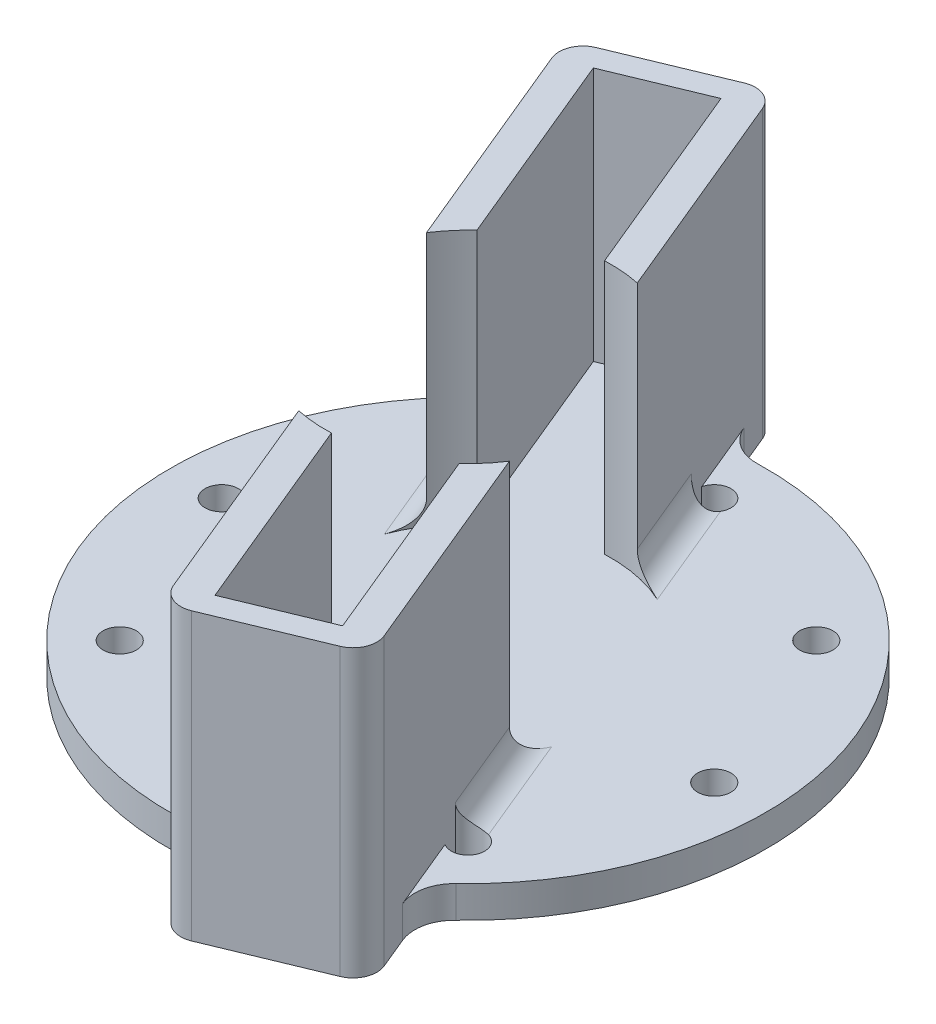
from build123d import *

# Parameters (mm, degrees)
CROQUIS2_R                   = 37.5
SALIENTE_EXTRUIR1_DEPTH      = 4
CROQUIS3_R                   = 2.1
CORTAR_EXTRUIR1_DEPTH        = 4
SALIENTE_EXTRUIR2_DEPTH      = 20
SALIENTE_EXTRUIR2_DEPTH_BACK = 4
SALIENTE_EXTRUIR3_DEPTH      = 20
SALIENTE_EXTRUIR3_DEPTH_BACK = 4
CORTAR_EXTRUIR2_DEPTH        = 20
CROQUIS9_R                   = 18
CORTAR_EXTRUIR3_DEPTH        = 20
REDONDEO1_R                  = 3
REDONDEO2_R                  = 3
REDONDEO3_R                  = 5
CORTAR_EXTRUIR4_DEPTH        = 20
SALIENTE_EXTRUIR4_START      = 12
SALIENTE_EXTRUIR4_DEPTH      = 12


with BuildPart() as part:
    # Croquis2 → Saliente-Extruir1 (new body)
    with BuildSketch(Plane(origin=(0, 0, 0), x_dir=(1, 0, 0), z_dir=(0, 1, 0))):
        with Locations(Location((0, 0, 0), (0, 0, 270))):
            Circle(CROQUIS2_R)
    extrude(amount=SALIENTE_EXTRUIR1_DEPTH)

    # Croquis3 → Cortar-Extruir1 (cut)
    with BuildSketch(Plane(origin=(0, 4, 0), x_dir=(1, 0, 0), z_dir=(0, 1, 0))):
        with Locations(Location((0, 31, 0), (0, 0, 270))):
            Circle(CROQUIS3_R)
        with Locations(Location((21.920310217, 21.920310217, 0), (0, 0, 270))):
            Circle(CROQUIS3_R)
        with Locations(Location((31, 0, 0), (0, 0, 270))):
            Circle(CROQUIS3_R)
        with Locations(Location((21.920310217, -21.920310217, 0), (0, 0, 270))):
            Circle(CROQUIS3_R)
        with Locations(Location((0, -31, 0), (0, 0, 270))):
            Circle(CROQUIS3_R)
        with Locations(Location((-21.920310217, -21.920310217, 0), (0, 0, 270))):
            Circle(CROQUIS3_R)
        with Locations(Location((-31, 0, 0), (0, 0, 270))):
            Circle(CROQUIS3_R)
        with Locations(Location((-21.920310217, 21.920310217, 0), (0, 0, 270))):
            Circle(CROQUIS3_R)
    extrude(amount=-CORTAR_EXTRUIR1_DEPTH, mode=Mode.SUBTRACT)

    # Croquis4 → Saliente-Extruir2 (add, two sides: drawn at the far end of the back side and taken through both)
    with BuildSketch(Plane(origin=(0, 4, 0), x_dir=(1, 0, 0), z_dir=(0, 1, 0)).offset(-SALIENTE_EXTRUIR2_DEPTH_BACK)):
        with BuildLine():
            ThreePointArc((8.474466938, -36.529897483), (11.451375588, -35.708766391), (14.350628714, -34.645482469))
            Line((14.350628714, -34.645482469), (-14.350628714, 34.645482469))
            ThreePointArc((-14.350628714, 34.645482469), (-17.15256553, 33.347256195), (-19.838185188, 31.822891265))
            Line((-19.838185188, 31.822891265), (8.474466938, -36.529897483))
        make_face()
        with BuildLine():
            Line((-14.350628714, 34.645482469), (14.350628714, -34.645482469))
            ThreePointArc((14.350628714, -34.645482469), (17.15256553, -33.347256195), (19.838185188, -31.822891265))
            Line((19.838185188, -31.822891265), (-8.474466938, 36.529897483))
            ThreePointArc((-8.474466938, 36.529897483), (-11.451375588, 35.708766391), (-14.350628714, 34.645482469))
        make_face()
        with BuildLine():
            Line((10.773528467, -42.080323007), (16.455387592, -39.726819898))
            Line((16.455387592, -39.726819898), (14.350628714, -34.645482469))
            ThreePointArc((14.350628714, -34.645482469), (11.451375588, -35.708766391), (8.474466938, -36.529897483))
            Line((8.474466938, -36.529897483), (10.773528467, -42.080323007))
        make_face()
        with BuildLine():
            Line((14.350628714, -34.645482469), (16.455387592, -39.726819898))
            Line((16.455387592, -39.726819898), (22.137246717, -37.373316789))
            Line((22.137246717, -37.373316789), (19.838185188, -31.822891265))
            ThreePointArc((19.838185188, -31.822891265), (17.15256553, -33.347256195), (14.350628714, -34.645482469))
        make_face()
        with BuildLine():
            ThreePointArc((-19.838185188, 31.822891265), (-17.15256553, 33.347256195), (-14.350628714, 34.645482469))
            Line((-14.350628714, 34.645482469), (-16.455387592, 39.726819898))
            Line((-16.455387592, 39.726819898), (-22.137246717, 37.373316789))
            Line((-22.137246717, 37.373316789), (-19.838185188, 31.822891265))
        make_face()
        with BuildLine():
            Line((-16.455387592, 39.726819898), (-14.350628714, 34.645482469))
            ThreePointArc((-14.350628714, 34.645482469), (-11.451375588, 35.708766391), (-8.474466938, 36.529897483))
            Line((-8.474466938, 36.529897483), (-10.773528467, 42.080323007))
            Line((-10.773528467, 42.080323007), (-16.455387592, 39.726819898))
        make_face()
    extrude(amount=SALIENTE_EXTRUIR2_DEPTH + SALIENTE_EXTRUIR2_DEPTH_BACK)

    # Croquis6 → Saliente-Extruir3 (add, two sides: drawn at the far end of the back side and taken through both)
    with BuildSketch(Plane(origin=(0, 4, 0), x_dir=(1, 0, 0), z_dir=(0, 1, 0)).offset(-SALIENTE_EXTRUIR3_DEPTH_BACK)):
        Polygon((-27.363498576, 39.53810119), (8.608744066, -47.306574867), (27.363498576, -39.53810119), (-8.608744066, 47.306574867), align=None)
        Polygon((-22.137246717, 37.373316789), (10.773528467, -42.080323007), (22.137246717, -37.373316789), (-10.773528467, 42.080323007), align=None, mode=Mode.SUBTRACT)
    extrude(amount=SALIENTE_EXTRUIR3_DEPTH + SALIENTE_EXTRUIR3_DEPTH_BACK)

    # Croquis8 → Cortar-Extruir2 (cut)
    with BuildSketch(Plane(origin=(0, 24, 0), x_dir=(1, 0, 0), z_dir=(0, 1, 0))):
        Polygon((-10.773528467, 42.080323007), (-22.137246717, 37.373316789), (10.773528467, -42.080323007), (22.137246717, -37.373316789), align=None)
    extrude(amount=-CORTAR_EXTRUIR2_DEPTH, mode=Mode.SUBTRACT)

    # Croquis9 → Cortar-Extruir3 (cut)
    with BuildSketch(Plane(origin=(0, 24, 0), x_dir=(1, 0, 0), z_dir=(0, 1, 0))):
        Circle(CROQUIS9_R)
    extrude(amount=-CORTAR_EXTRUIR3_DEPTH, mode=Mode.SUBTRACT)

    # Redondeo1
    redondeo1_edges = [part.edges().sort_by_distance(p)[0] for p in [
        (1.285328501, 4, -23.420170689),
        (-1.285328501, 4, 23.420170689),
        (-17.469426009, 4, -15.651697012),
        (17.469426009, 4, 15.651697012),
    ]]
    fillet(redondeo1_edges, radius=REDONDEO1_R)

    # Redondeo2
    redondeo2_edges = [part.edges().sort_by_distance(p)[0] for p in [
        (8.608744066, 12, 47.306574867),
        (-8.608744066, 12, -47.306574867),
        (-27.363498576, 12, -39.53810119),
        (27.363498576, 12, 39.53810119),
    ]]
    fillet(redondeo2_edges, radius=REDONDEO2_R)

    # Redondeo3
    redondeo3_edges = [part.edges().sort_by_distance(p)[0] for p in [
        (-23.192341919, 2, -29.468038216),
        (4.437587409, 2, 37.236511893),
        (23.192341919, 2, 29.468038216),
        (-4.437587409, 2, -37.236511893),
    ]]
    fillet(redondeo3_edges, radius=REDONDEO3_R)

    # Croquis10 → Cortar-Extruir4 (cut)
    with BuildSketch(Plane(origin=(0, 24, 0), x_dir=(1, 0, 0), z_dir=(0, 1, 0))):
        Polygon((10.773528467, -42.080323007), (22.137246717, -37.373316789), (22.519930149, -38.297196321), (11.156211899, -43.00420254), align=None)
        Polygon((-10.773528467, 42.080323007), (-22.137246717, 37.373316789), (-22.519930149, 38.297196321), (-11.156211899, 43.00420254), align=None)
    extrude(amount=-CORTAR_EXTRUIR4_DEPTH, mode=Mode.SUBTRACT)

    # Croquis11 → Saliente-Extruir4 (add)
    with BuildSketch(Plane(origin=(0, 24, 0), x_dir=(1, 0, 0), z_dir=(0, 1, 0)).offset(SALIENTE_EXTRUIR4_START)):
        with BuildLine():
            Line((22.519930149, -38.297196321), (11.156211899, -43.00420254))
            Line((11.156211899, -43.00420254), (0.791912926, -17.982571393))
            ThreePointArc((0.791912926, -17.982571393), (-1.459803938, -17.940707134), (-3.688668647, -17.617994313))
            Line((-3.688668647, -17.617994313), (7.460693769, -44.534936269))
            ThreePointArc((7.460693769, -44.534936269), (9.08428207, -46.158524569), (11.380382664, -46.158524569))
            Line((11.380382664, -46.158524569), (24.591859979, -40.686151487))
            ThreePointArc((24.591859979, -40.686151487), (26.215448279, -39.062563186), (26.215448279, -36.766462592))
            Line((26.215448279, -36.766462592), (15.066085863, -9.849520636))
            ThreePointArc((15.066085863, -9.849520636), (13.718232938, -11.65375841), (12.155631176, -13.275565175))
            Line((12.155631176, -13.275565175), (22.519930149, -38.297196321))
        make_face()
        with BuildLine():
            Line((-22.519930149, 38.297196321), (-11.156211899, 43.00420254))
            Line((-11.156211899, 43.00420254), (-0.791912926, 17.982571393))
            ThreePointArc((-0.791912926, 17.982571393), (1.459803938, 17.940707134), (3.688668647, 17.617994313))
            Line((3.688668647, 17.617994313), (-7.460693769, 44.534936269))
            ThreePointArc((-7.460693769, 44.534936269), (-9.08428207, 46.158524569), (-11.380382664, 46.158524569))
            Line((-11.380382664, 46.158524569), (-24.591859979, 40.686151487))
            ThreePointArc((-24.591859979, 40.686151487), (-26.215448279, 39.062563186), (-26.215448279, 36.766462592))
            Line((-26.215448279, 36.766462592), (-15.066085863, 9.849520636))
            ThreePointArc((-15.066085863, 9.849520636), (-13.718232938, 11.65375841), (-12.155631176, 13.275565175))
            Line((-12.155631176, 13.275565175), (-22.519930149, 38.297196321))
        make_face()
    extrude(amount=-SALIENTE_EXTRUIR4_DEPTH)


solid = part.part
